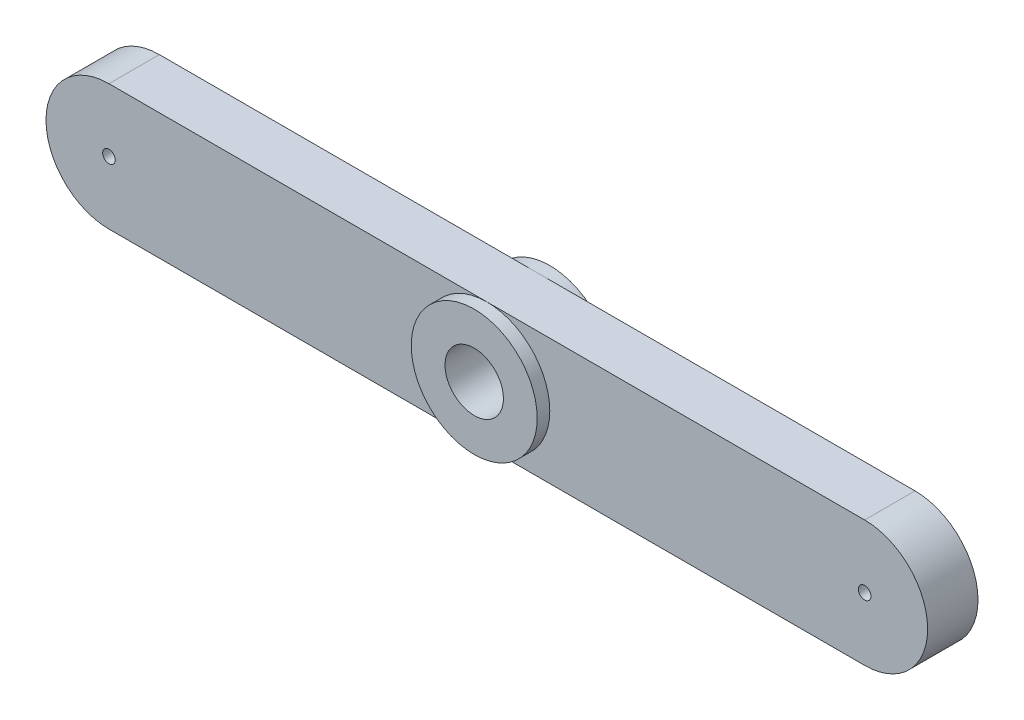
from build123d import *
from build123d.topology import SkipClean

# Parameters (mm, degrees)
BOSS_EXTRUDE2_DEPTH = 1
SKETCH2_R           = 2.5
SKETCH2_R_2         = 1.159513831
BOSS_EXTRUDE3_DEPTH = 1.5


with BuildPart() as part:
    # Sketch1 → Boss-Extrude2 (new, symmetric)
    with BuildSketch(Plane.XY):
        with BuildLine():
            ThreePointArc((-12.5, 0), (-13.232233047, -1.767766953), (-15, -2.5))
            Line((-15, -2.5), (0, -2.5))
            ThreePointArc((0, -2.5), (-2.5, -1.2e-08), (-2.3e-08, 2.5))
            Line((-2.3e-08, 2.5), (-15, 2.5))
            ThreePointArc((-15, 2.5), (-13.232233047, 1.767766953), (-12.5, 0))
        make_face()
        with BuildLine():
            ThreePointArc((-15, 2.5), (-17.5, 0), (-15, -2.5))
            Line((-15, -2.5), (-15, -0.25))
            ThreePointArc((-15, -0.25), (-15.25, 0), (-15, 0.25))
            Line((-15, 0.25), (-15, 2.5))
        make_face()
        with BuildLine():
            Line((-15, -0.25), (-15, -2.5))
            ThreePointArc((-15, -2.5), (-13.232233047, -1.767766953), (-12.5, 0))
            ThreePointArc((-12.5, 0), (-13.232233047, 1.767766953), (-15, 2.5))
            Line((-15, 2.5), (-15, 0.25))
            ThreePointArc((-15, 0.25), (-14.823223305, 0.176776695), (-14.75, 0))
            ThreePointArc((-14.75, 0), (-14.823223305, -0.176776695), (-15, -0.25))
        make_face()
        with BuildLine():
            ThreePointArc((-15, 2.5), (-17.5, 0), (-15, -2.5))
            Line((-15, -2.5), (-15, -0.25))
            ThreePointArc((-15, -0.25), (-15.25, 0), (-15, 0.25))
            Line((-15, 0.25), (-15, 2.5))
        make_face()
        with BuildLine():
            Line((-15, -0.25), (-15, -2.5))
            ThreePointArc((-15, -2.5), (-13.232233047, -1.767766953), (-12.5, 0))
            ThreePointArc((-12.5, 0), (-13.232233047, 1.767766953), (-15, 2.5))
            Line((-15, 2.5), (-15, 0.25))
            ThreePointArc((-15, 0.25), (-14.823223305, 0.176776695), (-14.75, 0))
            ThreePointArc((-14.75, 0), (-14.823223305, -0.176776695), (-15, -0.25))
        make_face()
        with BuildLine():
            ThreePointArc((2.5, 0), (1.767766953, -1.767766953), (0, -2.5))
            Line((0, -2.5), (15, -2.5))
            ThreePointArc((15, -2.5), (12.5, 0), (15, 2.5))
            Line((15, 2.5), (-2.3e-08, 2.5))
            ThreePointArc((-2.3e-08, 2.5), (1.767766945, 1.767766961), (2.5, 0))
        make_face()
        with BuildLine():
            ThreePointArc((15, 2.5), (12.5, 0), (15, -2.5))
            Line((15, -2.5), (15, -0.25))
            ThreePointArc((15, -0.25), (14.75, 0), (15, 0.25))
            Line((15, 0.25), (15, 2.5))
        make_face()
        with BuildLine():
            Line((15, -0.25), (15, -2.5))
            ThreePointArc((15, -2.5), (16.767766953, -1.767766953), (17.5, 0))
            ThreePointArc((17.5, 0), (16.767766953, 1.767766953), (15, 2.5))
            Line((15, 2.5), (15, 0.25))
            ThreePointArc((15, 0.25), (15.176776695, 0.176776695), (15.25, 0))
            ThreePointArc((15.25, 0), (15.176776695, -0.176776695), (15, -0.25))
        make_face()
        with BuildLine():
            ThreePointArc((15, 2.5), (12.5, 0), (15, -2.5))
            Line((15, -2.5), (15, -0.25))
            ThreePointArc((15, -0.25), (14.75, 0), (15, 0.25))
            Line((15, 0.25), (15, 2.5))
        make_face()
        with BuildLine():
            Line((15, -0.25), (15, -2.5))
            ThreePointArc((15, -2.5), (16.767766953, -1.767766953), (17.5, 0))
            ThreePointArc((17.5, 0), (16.767766953, 1.767766953), (15, 2.5))
            Line((15, 2.5), (15, 0.25))
            ThreePointArc((15, 0.25), (15.176776695, 0.176776695), (15.25, 0))
            ThreePointArc((15.25, 0), (15.176776695, -0.176776695), (15, -0.25))
        make_face()
    extrude(amount=BOSS_EXTRUDE2_DEPTH, both=True)

    # Sketch2 → Boss-Extrude3 (add, symmetric)
    with SkipClean():  # the faces are left unmerged after this step: merging them gives an invalid solid
        with BuildSketch(Plane.XY):
            with Locations(Location((0, 0, 0), (0, 0, 270))):
                Circle(SKETCH2_R)
            Circle(SKETCH2_R_2, mode=Mode.SUBTRACT)
        extrude(amount=BOSS_EXTRUDE3_DEPTH, both=True)


solid = part.part
